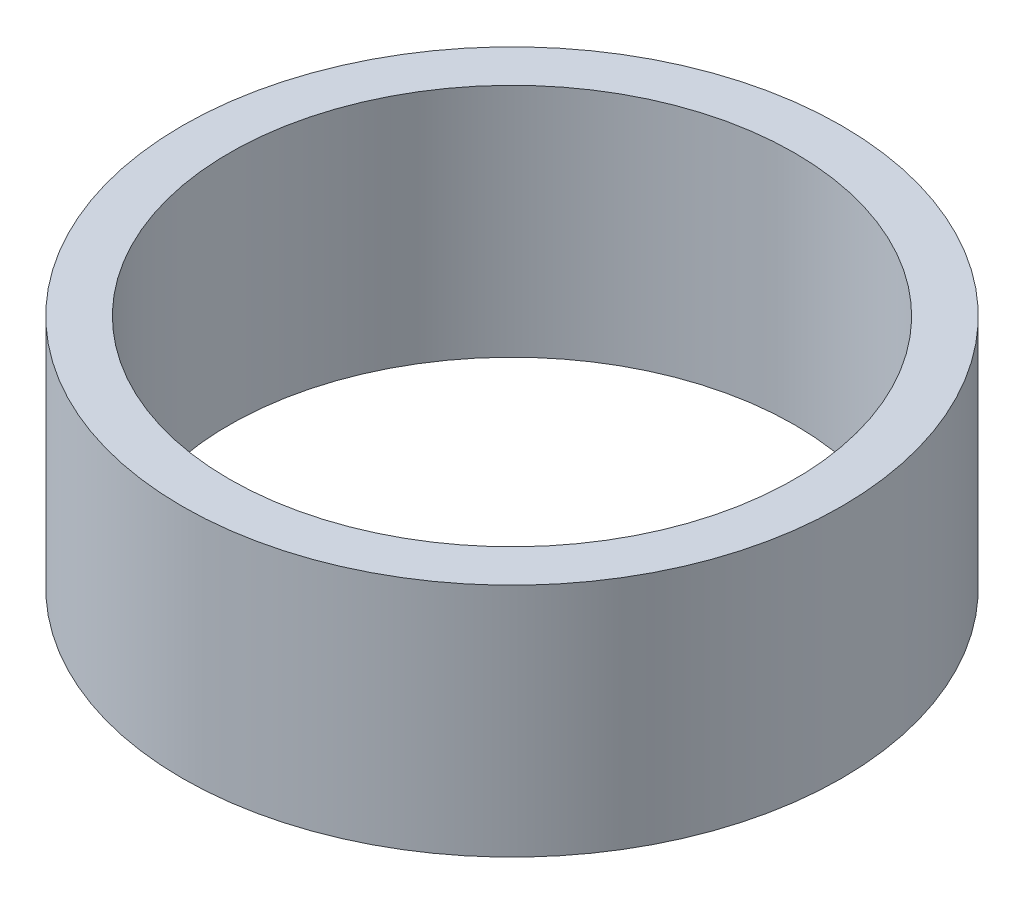
from build123d import *

# Parameters (mm, degrees)
SKETCH1_R           = 22.225
SKETCH1_R_2         = 19.05
BOSS_EXTRUDE1_DEPTH = 15.875


with BuildPart() as part:
    # Sketch1 → Boss-Extrude1 (new body)
    with BuildSketch(Plane(origin=(0, 0, 0), x_dir=(1, 0, 0), z_dir=(0, 1, 0))):
        with Locations(Location((0, 0, 0), (0, 0, 270))):
            Circle(SKETCH1_R)
        with Locations(Location((0, 0, 0), (0, 0, 270))):
            Circle(SKETCH1_R_2, mode=Mode.SUBTRACT)
    extrude(amount=BOSS_EXTRUDE1_DEPTH)


solid = part.part
